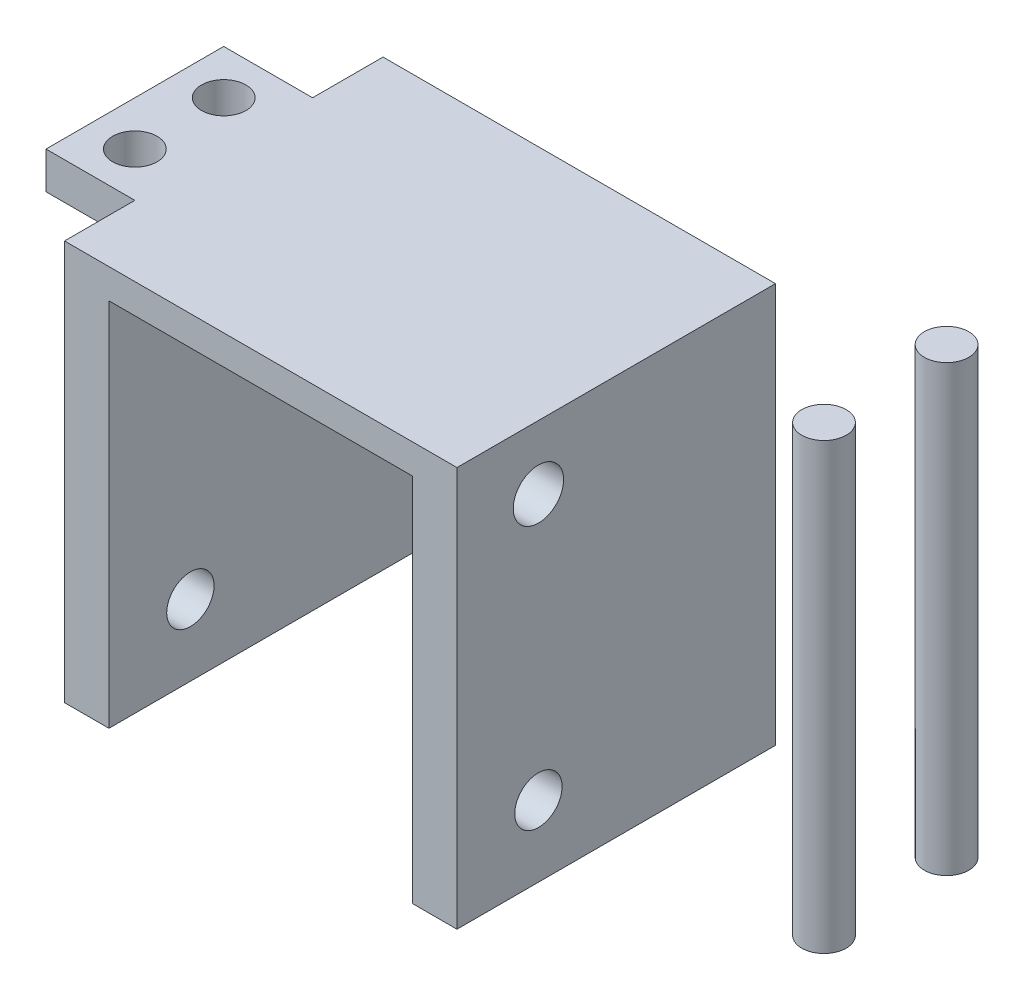
from build123d import *

# Parameters (mm, degrees)
SKETCH1_W             = 26.5
SKETCH1_H             = 27
BOSS_EXTRUDE1_DEPTH   = 36.7
SKETCH2_W             = 20.5
SKETCH2_H             = 25
CUT_EXTRUDE1_DEPTH    = 36.7
SKETCH3_R             = 1.7
SKETCH3_R_2           = 1.6
CUT_EXTRUDE2_DEPTH    = 36.7
SKETCH4_R             = 3
CUT_EXTRUDE3_DEPTH    = 36.7
SKETCH8_R             = 1.5
BOSS_EXTRUDE3_DEPTH   = 30
BOSS_EXTRUDE3_2_DEPTH = 30
SKETCH9_W             = 5.918746276
SKETCH9_H             = 6
SKETCH9_W_2           = 6.707912446
CUT_EXTRUDE4_DEPTH    = 12
SKETCH11_W            = 15.191448775
SKETCH11_H            = 37.067540439
CUT_EXTRUDE6_DEPTH    = 32
SKETCH12_W            = 12
SKETCH12_H            = 2.5
BOSS_EXTRUDE4_DEPTH   = 6
SKETCH13_R            = 1.5
CUT_EXTRUDE7_DEPTH    = 6
SKETCH14_W            = 11.732424075
SKETCH14_H            = 31.976606793
CUT_EXTRUDE8_DEPTH    = 10
SKETCH15_W            = 6
SKETCH15_H            = 12.008551225
SKETCH15_R            = 1.5
BOSS_EXTRUDE5_DEPTH   = 2.5
SKETCH17_W            = 99.088440485
SKETCH17_H            = 65.829588933
CUT_EXTRUDE9_DEPTH    = 50


with BuildPart() as part:
    # Sketch1 → Boss-Extrude1 (new body)
    with BuildSketch(Plane.XY):
        with Locations((-15.427732696, -21.46401366)):
            Rectangle(SKETCH1_W, SKETCH1_H)
    extrude(amount=BOSS_EXTRUDE1_DEPTH)

    # Sketch2 → Cut-Extrude1 (cut)
    with BuildSketch(Plane(origin=(0, 0, 0), x_dir=(-1, 0, 0), z_dir=(0, 0, -1))):
        with Locations((15.427732696, -22.46401366)):
            Rectangle(SKETCH2_W, SKETCH2_H)
    extrude(amount=-CUT_EXTRUDE1_DEPTH, mode=Mode.SUBTRACT)

    # Sketch3 → Cut-Extrude2 (cut)
    with BuildSketch(Plane(origin=(-2.177732696, 0, 0), x_dir=(0, 0, -1), z_dir=(1, 0, 0))):
        with Locations(Location((-31.2, -12.26401366, 0), (0, 0, 90))):
            Circle(SKETCH3_R)
        with Locations(Location((-31.2, -30.16401366, 0), (0, 0, 90))):
            Circle(SKETCH3_R_2)
    extrude(amount=-CUT_EXTRUDE2_DEPTH, mode=Mode.SUBTRACT)

    # Sketch4 → Cut-Extrude3 (cut)
    with BuildSketch(Plane(origin=(-2.177732696, 0, 0), x_dir=(0, 0, -1), z_dir=(1, 0, 0))):
        with Locations(Location((-12.025092395, -21.16401366, 0), (0, 0, 90))):
            Circle(SKETCH4_R)
    extrude(amount=-CUT_EXTRUDE3_DEPTH, mode=Mode.SUBTRACT)

    # Sketch9 → Cut-Extrude4 (cut)
    with BuildSketch(Plane(origin=(0, 0, 0), x_dir=(-1, 0, 0), z_dir=(0, 0, -1))):
        with Locations((3.689038825, -21.16401366)):
            Rectangle(SKETCH9_W, SKETCH9_H)
        with Locations((28.103867214, -21.16401366)):
            Rectangle(SKETCH9_W_2, SKETCH9_H)
    extrude(amount=-CUT_EXTRUDE4_DEPTH, mode=Mode.SUBTRACT)

    # Sketch11 → Cut-Extrude6 (cut)
    with BuildSketch(Plane.ZY.offset(28.677732696)):
        with Locations((7.595724388, -16.43024344)):
            Rectangle(SKETCH11_W, SKETCH11_H)
    extrude(amount=-CUT_EXTRUDE6_DEPTH, mode=Mode.SUBTRACT)

    # Sketch12 → Boss-Extrude4 (add)
    with BuildSketch(Plane.ZY.offset(28.677732696)):
        with Locations((25.95, -9.21401366)):
            Rectangle(SKETCH12_W, SKETCH12_H)
    extrude(amount=BOSS_EXTRUDE4_DEPTH)

    # Sketch13 → Cut-Extrude7 (cut)
    with BuildSketch(Plane(origin=(0, -7.96401366, 0), x_dir=(1, 0, 0), z_dir=(0, 1, 0))):
        with Locations(Location((-31.677732696, -22.95, 0), (0, 0, 180))):
            Circle(SKETCH13_R)
        with Locations(Location((-31.677732696, -28.95, 0), (0, 0, 180))):
            Circle(SKETCH13_R)
    extrude(amount=-CUT_EXTRUDE7_DEPTH, mode=Mode.SUBTRACT)


with BuildPart() as body_2:
    # Sketch8 → Boss-Extrude3 (new body)
    with BuildSketch(Plane(origin=(0, -7.96401366, 0), x_dir=(1, 0, 0), z_dir=(0, 1, 0))):
        with Locations(Location((7.15742756, -12.973989901, 0), (0, 0, 180))):
            Circle(SKETCH8_R)
    extrude(amount=-BOSS_EXTRUDE3_DEPTH)


with BuildPart() as body_3:
    # Sketch8 → Boss-Extrude3 2 (new body)
    with BuildSketch(Plane(origin=(0, -7.96401366, 0), x_dir=(1, 0, 0), z_dir=(0, 1, 0))):
        with Locations(Location((7.574350551, -21.669812293, 0), (0, 0, 180))):
            Circle(SKETCH8_R)
    extrude(amount=-BOSS_EXTRUDE3_2_DEPTH)


with BuildPart() as body_4:
    # Body-Move/Copy4: copy of part
    add(part.part.moved(Location((-70.821628829, 0, 0))))

    # Sketch14 → Cut-Extrude8 (cut)
    with BuildSketch(Plane(origin=(0, -7.96401366, 0), x_dir=(1, 0, 0), z_dir=(0, 1, 0))):
        with Locations((-105.365573562, -18.867606945)):
            Rectangle(SKETCH14_W, SKETCH14_H)
    extrude(amount=-CUT_EXTRUDE8_DEPTH, mode=Mode.SUBTRACT)

    # Sketch15 → Boss-Extrude5 (add)
    with BuildSketch(Plane(origin=(0, -7.96401366, 0), x_dir=(1, 0, 0), z_dir=(0, 1, 0))):
        with Locations((-69.999361524, -25.945724388)):
            Rectangle(SKETCH15_W, SKETCH15_H)
        with Locations(Location((-69.999361524, -22.941448775, 0), (0, 0, 180))):
            Circle(SKETCH15_R, mode=Mode.SUBTRACT)
        with Locations(Location((-69.999361524, -28.95, 0), (0, 0, 180))):
            Circle(SKETCH15_R, mode=Mode.SUBTRACT)
    extrude(amount=-BOSS_EXTRUDE5_DEPTH)


with BuildPart() as body_5:
    # Body-Move/Copy5: copy of body 2
    add(body_2.part.moved(Location((-69.754488263, 0, 0))))


with BuildPart() as body_6:
    # Body-Move/Copy6: copy of body 3
    add(body_3.part.moved(Location((-71.521118541, 0, 0))))


with BuildPart() as cut_extrude9_tool:
    # Sketch17 → Cut-Extrude9 (new body)
    with BuildSketch(Plane(origin=(0, -7.96401366, 0), x_dir=(1, 0, 0), z_dir=(0, 1, 0))):
        with Locations((-104.540526015, -10.422992559)):
            Rectangle(SKETCH17_W, SKETCH17_H)
    extrude(amount=-CUT_EXTRUDE9_DEPTH)


with BuildPart() as body_4_1:
    add(body_4.part)

    # Cut-Extrude9: cut by cut_extrude9_tool
    add(cut_extrude9_tool.part, mode=Mode.SUBTRACT)


with BuildPart() as body_5_1:
    add(body_5.part)

    # Cut-Extrude9: cut by cut_extrude9_tool
    add(cut_extrude9_tool.part, mode=Mode.SUBTRACT)


with BuildPart() as body_6_1:
    add(body_6.part)

    # Cut-Extrude9: cut by cut_extrude9_tool
    add(cut_extrude9_tool.part, mode=Mode.SUBTRACT)


solid = Compound([part.part, body_2.part, body_3.part])
